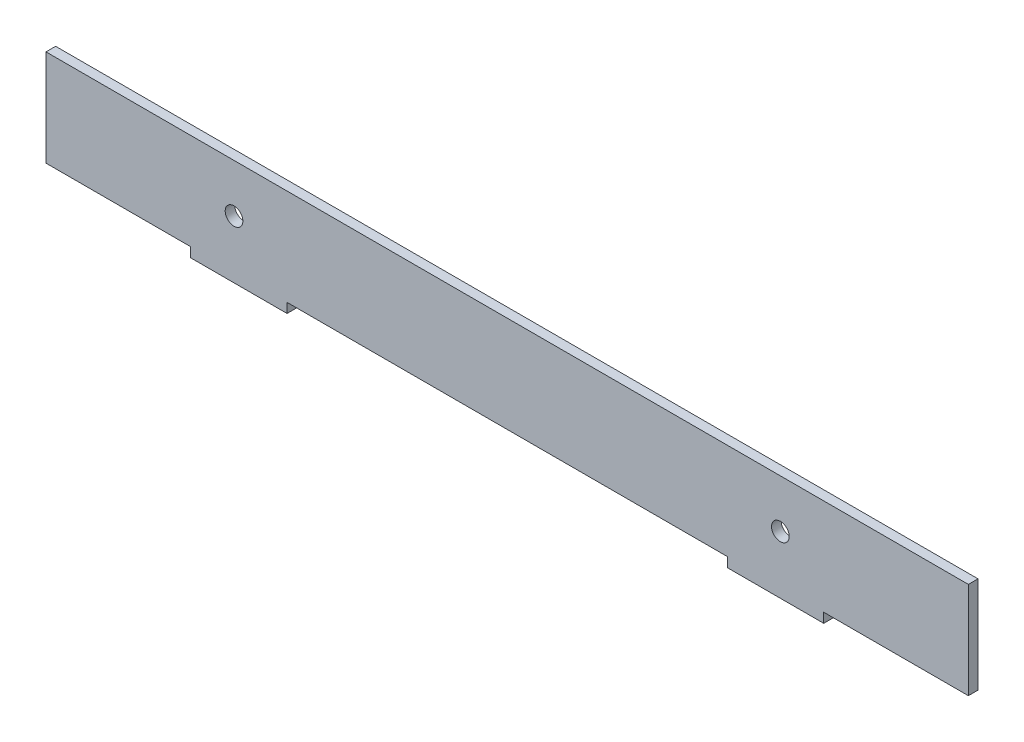
from build123d import *

# Parameters (mm, degrees)
SALIENTE_EXTRUIR1_DEPTH      = 1.5
TALADRO_DE_MARGEN_PARA_M51_D = 5.5


with BuildPart() as part:
    # Croquis1 → Saliente-Extruir1 (new, symmetric)
    with BuildSketch(Plane.XY):
        Polygon((-143.5, -15), (-98.5, -15), (-98.5, -18), (-68.5, -18), (-68.5, -15), (68.5, -15), (68.5, -18), (98.5, -18), (98.5, -15), (143.5, -15), (143.5, 15), (-143.5, 15), align=None)
    extrude(amount=SALIENTE_EXTRUIR1_DEPTH, both=True)

    # Taladro de margen para M51 (through all)
    with Locations(Plane.XY.offset(1.5)):
        with Locations((-85, 0), (85, 0)):
            Hole(TALADRO_DE_MARGEN_PARA_M51_D / 2)


solid = part.part
